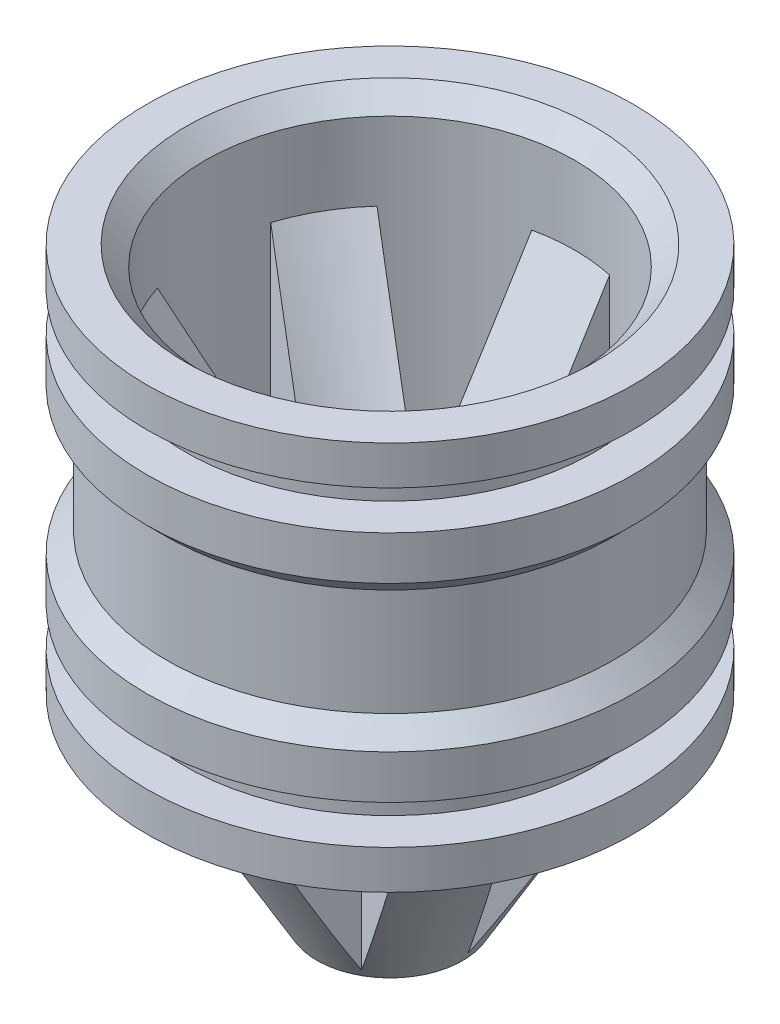
from build123d import *

# Parameters (mm, degrees)
SKETCH1_R           = 15.875
BOSS_EXTRUDE1_DEPTH = 25.4
SKETCH2_R           = 1.35
CUT_EXTRUDE2_DEPTH  = 25.4
CUT_EXTRUDE3_DEPTH  = 12.7
CUT_EXTRUDE5_DEPTH  = 39.885649667
SKETCH7_W           = 2.54
SKETCH7_H           = 2.54


with BuildPart() as part:
    # Sketch1 → Boss-Extrude1 (new body)
    with BuildSketch(Plane(origin=(0, 0, 0), x_dir=(1, 0, 0), z_dir=(0, 1, 0))):
        with Locations(Location((0, 0, 0), (0, 0, 270))):
            Circle(SKETCH1_R)
    extrude(amount=BOSS_EXTRUDE1_DEPTH)

    # Sketch2 → Cut-Extrude2 (cut)
    with BuildSketch(Plane(origin=(0, 25.4, 0), x_dir=(1, 0, 0), z_dir=(0, 1, 0))):
        with Locations(Location((0, 0, 0), (0, 0, 270))):
            Circle(SKETCH2_R)
    extrude(amount=-CUT_EXTRUDE2_DEPTH, mode=Mode.SUBTRACT)

    # Sketch3 → Revolve2 (revolve)
    with BuildSketch(Plane.XY):
        Polygon((0, 0), (0, -12.7), (-4.7625, -12.7), (-10.204772628, -3.2737073), (-15.875, 0), align=None)
    revolve(axis=Axis((0, 0, 0), (0, -1, 0)))

    # Sketch4 → Cut-Extrude3 (cut)
    with BuildSketch(Plane.XZ.offset(12.7)):
        with BuildLine():
            Line((1.412444273, -2.646696276), (2.987644573, 0.271992474))
            ThreePointArc((2.987644573, 0.271992474), (-2.640053308, 1.424822281), (1.412444273, -2.646696276))
        make_face()
    extrude(amount=-CUT_EXTRUDE3_DEPTH, mode=Mode.SUBTRACT)

    # Sketch5 → Cut-Revolve1 (revolve, cut)
    with BuildSketch(Plane.XY, mode=Mode.PRIVATE) as cut_revolve1_sk:
        Polygon((-12.065, 24.13), (-12.065, 19.05), (-6.35, 9.525), (-3.175, 9.525), (-3.175, 6.35), (0, 6.35), (0, 25.4), (-13.335, 25.4), align=None)
    revolve(cut_revolve1_sk.sketch.rotate(Axis((0, 6.35, 0), (0, 1, 0)), 270), axis=Axis((0, 6.35, 0), (0, 1, 0)), mode=Mode.SUBTRACT)

    # Sketch6 → Cut-Extrude5 (cut, through all)
    with BuildSketch(Plane(origin=(0, 19.05, 0), x_dir=(1, 0, 0), z_dir=(0, 1, 0))):
        with BuildLine():
            Line((-5.08, 0), (-11.484424543, 3.697596234))
            ThreePointArc((-11.484424543, 3.697596234), (-12.065, 0), (-11.484424543, -3.697596234))
            Line((-11.484424543, -3.697596234), (-5.08, 0))
        make_face()
        with BuildLine():
            Line((-2.54, 4.399409051), (-2.54, 11.794601519))
            ThreePointArc((-2.54, 11.794601519), (-6.0325, 10.448596497), (-8.944424543, 8.097005285))
            Line((-8.944424543, 8.097005285), (-2.54, 4.399409051))
        make_face()
        with BuildLine():
            Line((2.54, 4.399409051), (8.944424543, 8.097005285))
            ThreePointArc((8.944424543, 8.097005285), (6.0325, 10.448596497), (2.54, 11.794601519))
            Line((2.54, 11.794601519), (2.54, 4.399409051))
        make_face()
        with BuildLine():
            Line((5.08, 0), (11.484424543, -3.697596234))
            ThreePointArc((11.484424543, -3.697596234), (12.065, 0), (11.484424543, 3.697596234))
            Line((11.484424543, 3.697596234), (5.08, 0))
        make_face()
        with BuildLine():
            Line((2.54, -4.399409051), (2.54, -11.794601519))
            ThreePointArc((2.54, -11.794601519), (6.0325, -10.448596497), (8.944424543, -8.097005285))
            Line((8.944424543, -8.097005285), (2.54, -4.399409051))
        make_face()
        with BuildLine():
            Line((-8.944424543, -8.097005285), (-2.54, -4.399409051))
            Line((-2.54, -4.399409051), (-2.54, -11.794601519))
            ThreePointArc((-2.54, -11.794601519), (-6.0325, -10.448596497), (-8.944424543, -8.097005285))
        make_face()
    extrude(amount=-CUT_EXTRUDE5_DEPTH, mode=Mode.SUBTRACT)

    # Sketch7 → Cut-Revolve2 (revolve, cut)
    with BuildSketch(Plane.XY, mode=Mode.PRIVATE) as cut_revolve2_sk:
        with Locations((-14.605, 21.59)):
            Rectangle(SKETCH7_W, SKETCH7_H)
        with Locations((-14.605, 3.81)):
            Rectangle(SKETCH7_W, SKETCH7_H)
        Polygon((-15.875, 17.4625), (-15.875, 7.9375), (-14.605, 9.2075), (-14.605, 16.1925), align=None)
    revolve(cut_revolve2_sk.sketch.rotate(Axis((0, 0, 0), (0, 1, 0)), 270), axis=Axis((0, 0, 0), (0, 1, 0)), mode=Mode.SUBTRACT)


solid = part.part
